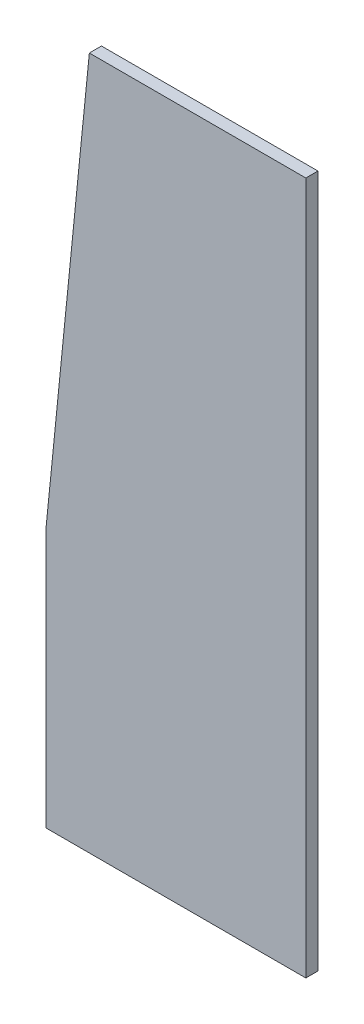
from build123d import *

# Parameters (mm, degrees)
BOSS_EXTRUDE1_DEPTH = 3.556


with BuildPart() as part:
    # Sketch1 → Boss-Extrude1 (new body)
    with BuildSketch(Plane.XY):
        Polygon((-42.952942124, 356.788581407), (-42.952942124, 280.588581407), (33.247057876, 280.588581407), (33.247057876, 483.788581407), (-30.252942124, 483.788581407), align=None)
    extrude(amount=BOSS_EXTRUDE1_DEPTH)


solid = part.part
